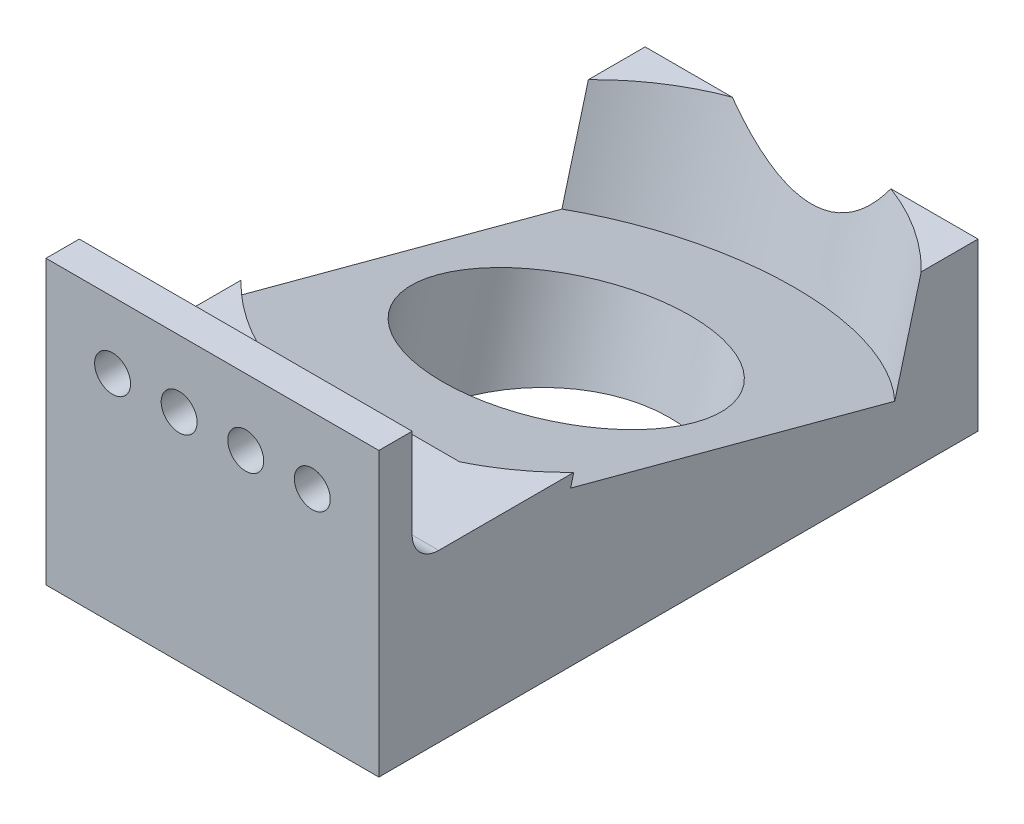
from build123d import *

# Parameters (mm, degrees)
SKETCH1_W               = 107.95
SKETCH1_H               = 31.75
BOSS_EXTRUDE1_DEPTH     = 31.75
SKETCH3_W               = 63.5
SKETCH3_H               = 76.2
SKETCH3_R               = 3.429
BOSS_EXTRUDE2_DEPTH     = 6.35
FILLET1_R               = 5.08
CUT_EXTRUDE1_DEPTH      = 119.79762203
CUT_EXTRUDE1_DEPTH_BACK = 119.79762203
SKETCH4_W               = 78.111463513
SKETCH4_H               = 26.600111828


with BuildPart() as part:
    # Sketch1 → Boss-Extrude1 (new, symmetric)
    with BuildSketch(Plane(origin=(0, 0, 0), x_dir=(0, 0, -1), z_dir=(1, 0, 0))):
        Rectangle(SKETCH1_W, SKETCH1_H)
    extrude(amount=BOSS_EXTRUDE1_DEPTH, both=True)

    # Sketch2 → Cut-Revolve1 (revolve, cut)
    with BuildSketch(Plane(origin=(0, 0, 0), x_dir=(0, 0, -1), z_dir=(1, 0, 0))):
        Polygon((30.787113889, -1.024256513), (21.709471638, -34.902478605), (-1.905, -28.575), (15.934173595, 38.001702221), (59.482939473, 26.332845573), (50.721408129, -6.365634557), align=None)
    revolve(axis=Axis((0, -21.465443212, 0), (0, 0.9659258262890701, -0.2588190451025143)), mode=Mode.SUBTRACT)

    # Sketch3 → Boss-Extrude2 (add)
    with BuildSketch(Plane.XY.offset(53.975)):
        Rectangle(SKETCH3_W, SKETCH3_H)
        with Locations((-19.05, 25.4)):
            Circle(SKETCH3_R, mode=Mode.SUBTRACT)
        with Locations((-6.35, 25.4)):
            Circle(SKETCH3_R, mode=Mode.SUBTRACT)
        with Locations((6.35, 25.4)):
            Circle(SKETCH3_R, mode=Mode.SUBTRACT)
        with Locations((19.05, 25.4)):
            Circle(SKETCH3_R, mode=Mode.SUBTRACT)
        with Locations((-6.35, -25.4)):
            Circle(SKETCH3_R, mode=Mode.SUBTRACT)
        with Locations((6.35, -25.4)):
            Circle(SKETCH3_R, mode=Mode.SUBTRACT)
        with Locations((19.05, -25.4)):
            Circle(SKETCH3_R, mode=Mode.SUBTRACT)
        with Locations((-19.05, -25.4)):
            Circle(SKETCH3_R, mode=Mode.SUBTRACT)
    extrude(amount=BOSS_EXTRUDE2_DEPTH)

    # Fillet1
    fillet1_edges = [part.edges().sort_by_distance(p)[0] for p in [
        (0, 15.875, 53.975),
        (0, -15.875, 53.975),
    ]]
    fillet(fillet1_edges, radius=FILLET1_R)

    # Sketch4 → Cut-Extrude1 (cut, two sides: drawn at the far end of the back side and taken through both)
    with BuildSketch(Plane(origin=(0, 0, 53.975), x_dir=(-1, 0, 0), z_dir=(0, 0, -1)).offset(-CUT_EXTRUDE1_DEPTH_BACK)):
        with Locations((-0.534278136, -29.175055914)):
            Rectangle(SKETCH4_W, SKETCH4_H)
    extrude(amount=CUT_EXTRUDE1_DEPTH + CUT_EXTRUDE1_DEPTH_BACK, mode=Mode.SUBTRACT)


solid = part.part
